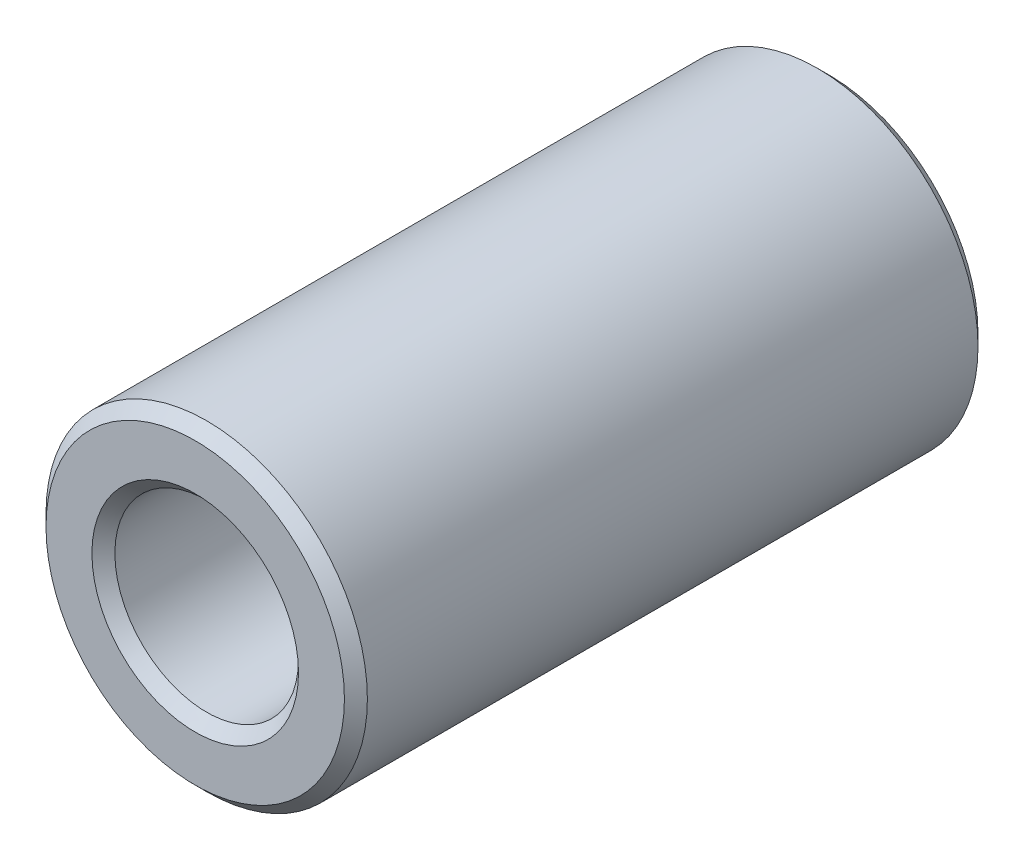
from build123d import *

# Parameters (mm, degrees)
ESQUISSE1_R          = 7
ESQUISSE1_R_2        = 4
BASE_EXTRUSION_DEPTH = 27.6
CHANFREIN2_SIZE      = 0.5


with BuildPart() as part:
    # Esquisse1 → Base-Extrusion (new body)
    with BuildSketch(Plane.XY):
        with Locations(Location((0, 0, 0), (0, 0, 180))):
            Circle(ESQUISSE1_R)
        with Locations(Location((0, 0, 0), (0, 0, 180))):
            Circle(ESQUISSE1_R_2, mode=Mode.SUBTRACT)
    extrude(amount=BASE_EXTRUSION_DEPTH)

    # Chanfrein2
    chanfrein2_edges = [part.edges().sort_by_distance(p)[0] for p in [
        (7, 0, 0),
        (7, 0, 27.6),
        (4, 0, 0),
        (4, 0, 27.6),
    ]]
    chamfer(chanfrein2_edges, length=CHANFREIN2_SIZE)


solid = part.part
